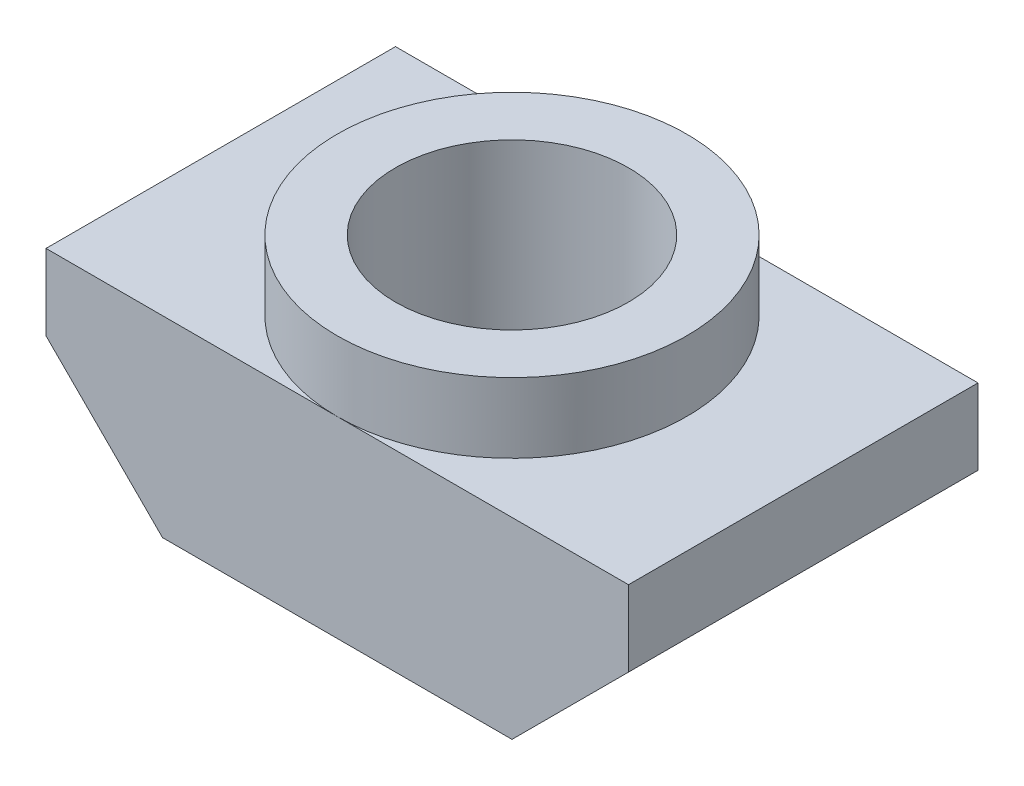
from build123d import *

# Parameters (mm, degrees)
SKETCH1_W               = 10
SKETCH1_H               = 6
BOSS_EXTRUDE1_DEPTH     = 3.3
SKETCH2_R               = 3
BOSS_EXTRUDE2_DEPTH     = 1.2
CUT_EXTRUDE1_DEPTH      = 8.365459931
CUT_EXTRUDE1_DEPTH_BACK = 8.365459931
SKETCH3_R               = 2
CHAMFER1_SIZE           = 2


with BuildPart() as part:
    # Sketch1 → Boss-Extrude1 (new body)
    with BuildSketch(Plane(origin=(0, 0, 0), x_dir=(1, 0, 0), z_dir=(0, 1, 0))):
        Rectangle(SKETCH1_W, SKETCH1_H)
    extrude(amount=-BOSS_EXTRUDE1_DEPTH)

    # Sketch2 → Boss-Extrude2 (add)
    with BuildSketch(Plane(origin=(0, 0, 0), x_dir=(1, 0, 0), z_dir=(0, 1, 0))):
        with Locations(Location((0, 0, 0), (0, 0, 270))):
            Circle(SKETCH2_R)
    extrude(amount=BOSS_EXTRUDE2_DEPTH)

    # Sketch3 → Cut-Extrude1 (cut, two sides: drawn at the far end of the back side and taken through both)
    with BuildSketch(Plane(origin=(0, 1.2, 0), x_dir=(1, 0, 0), z_dir=(0, 1, 0)).offset(-CUT_EXTRUDE1_DEPTH_BACK)):
        with Locations(Location((0, 0, 0), (0, 0, 270))):
            Circle(SKETCH3_R)
    extrude(amount=CUT_EXTRUDE1_DEPTH + CUT_EXTRUDE1_DEPTH_BACK, mode=Mode.SUBTRACT)

    # Chamfer1
    chamfer1_edges = [part.edges().sort_by_distance(p)[0] for p in [
        (-5, -3.3, 0),
        (5, -3.3, 0),
    ]]
    chamfer(chamfer1_edges, length=CHAMFER1_SIZE)


solid = part.part
